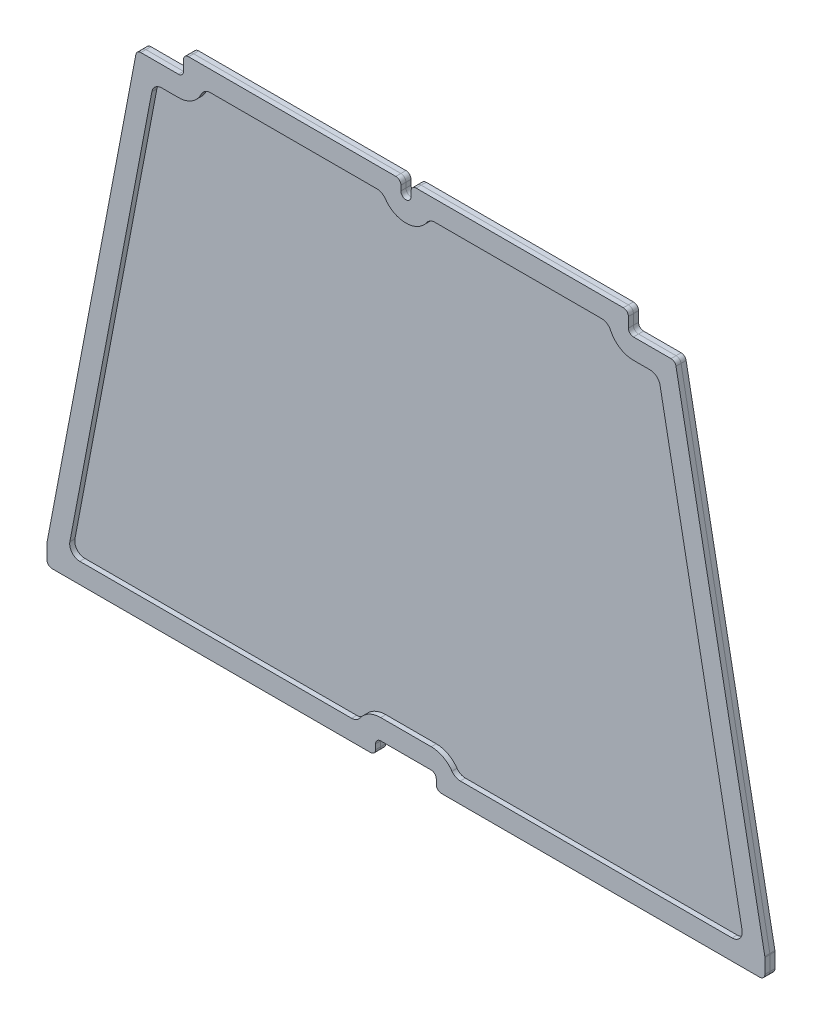
from build123d import *

# Parameters (mm, degrees)
EXTRUDE_1_DEPTH     = 5
CUT_EXTRUDE_1_DEPTH = 619.131054065
FILLET_1_R          = 5
EXTRUDE_2_DEPTH     = 5
FILLET_2_R          = 10


with BuildPart() as part:
    # ｽｹｯﾁ2 → ﾎﾞｽ - 押し出し1 (new body)
    with BuildSketch(Plane.XY):
        Polygon((355, 0), (-355, 0), (-355, 20), (-262.5, 506), (262.5, 506), (355, 20), align=None)
    extrude(amount=EXTRUDE_1_DEPTH)

    # ｽｹｯﾁ3 → ｶｯﾄ - 押し出し1 (cut, through all)
    with BuildSketch(Plane.XY.offset(5)):
        Polygon((-262.5, 506), (-266.306584362, 486), (-220, 486), (-220, 506), align=None)
        Polygon((262.5, 506), (220, 506), (220, 486), (266.306584362, 486), align=None)
        with BuildLine():
            Line((5, 506), (-5, 506))
            Line((-5, 506), (-5, 496))
            ThreePointArc((-5, 496), (0, 491), (5, 496))
            Line((5, 496), (5, 506))
        make_face()
        with BuildLine():
            Line((-30, 10), (-30, 0))
            Line((-30, 0), (30, 0))
            Line((30, 0), (30, 10))
            ThreePointArc((30, 10), (28.535533906, 13.535533906), (25, 15))
            Line((25, 15), (-25, 15))
            ThreePointArc((-25, 15), (-28.535533906, 13.535533906), (-30, 10))
        make_face()
    extrude(amount=-CUT_EXTRUDE_1_DEPTH, mode=Mode.SUBTRACT)

    # ﾌｨﾚｯﾄ1
    fillet_1_edges = [part.edges().sort_by_distance(p)[0] for p in [
        (-355, 20, 2.5),
        (355, 20, 2.5),
        (355, 0, 2.5),
        (-355, 0, 2.5),
        (-220, 486, 2.5),
        (-266.306584362, 486, 2.5),
        (-220, 506, 2.5),
        (266.306584362, 486, 2.5),
        (220, 486, 2.5),
        (220, 506, 2.5),
        (-5, 506, 2.5),
        (5, 506, 2.5),
        (30, 0, 2.5),
        (-30, 0, 2.5),
    ]]
    fillet(fillet_1_edges, radius=FILLET_1_R)


with BuildPart() as body_2:
    # ｽｹｯﾁ4 → ﾎﾞｽ - 押し出し2 (new body)
    with BuildSketch(Plane.XY.offset(5)):
        with BuildLine():
            Line((30, 10), (30, 5))
            ThreePointArc((30, 5), (31.464466094, 1.464466094), (35, 0))
            Line((35, 0), (350, 0))
            ThreePointArc((350, 0), (353.535533906, 1.464466094), (355, 5))
            Line((355, 5), (355, 19.528409825))
            ThreePointArc((355, 19.528409825), (354.977907561, 19.997916285), (354.911825474, 20.463273727))
            Line((354.911825474, 20.463273727), (267.080298537, 481.934863902))
            ThreePointArc((267.080298537, 481.934863902), (265.356394054, 484.851903394), (262.168473063, 486))
            Line((262.168473063, 486), (225, 486))
            ThreePointArc((225, 486), (221.464466094, 487.464466094), (220, 491))
            Line((220, 491), (220, 501))
            ThreePointArc((220, 501), (218.535533906, 504.535533906), (215, 506))
            Line((215, 506), (10, 506))
            ThreePointArc((10, 506), (6.464466094, 504.535533906), (5, 501))
            Line((5, 501), (5, 496))
            ThreePointArc((5, 496), (0, 491), (-5, 496))
            Line((-5, 496), (-5, 501))
            ThreePointArc((-5, 501), (-6.464466094, 504.535533906), (-10, 506))
            Line((-10, 506), (-215, 506))
            ThreePointArc((-215, 506), (-218.535533906, 504.535533906), (-220, 501))
            Line((-220, 501), (-220, 491))
            ThreePointArc((-220, 491), (-221.464466094, 487.464466094), (-225, 486))
            Line((-225, 486), (-262.168473063, 486))
            ThreePointArc((-262.168473063, 486), (-265.356394054, 484.851903394), (-267.080298537, 481.934863902))
            Line((-267.080298537, 481.934863902), (-354.911825474, 20.463273727))
            ThreePointArc((-354.911825474, 20.463273727), (-354.977907561, 19.997916285), (-355, 19.528409825))
            Line((-355, 19.528409825), (-355, 5))
            ThreePointArc((-355, 5), (-353.535533906, 1.464466094), (-350, 0))
            Line((-350, 0), (-35, 0))
            ThreePointArc((-35, 0), (-31.464466094, 1.464466094), (-30, 5))
            Line((-30, 5), (-30, 10))
            ThreePointArc((-30, 10), (-28.535533906, 13.535533906), (-25, 15))
            Line((-25, 15), (25, 15))
            ThreePointArc((25, 15), (28.535533906, 13.535533906), (30, 10))
        make_face()
        with BuildLine():
            Line((-225, 466), (-249.754139167, 466))
            Line((-249.754139167, 466), (-334.640970443, 20))
            Line((-334.640970443, 20), (-47.912878475, 20))
            ThreePointArc((-47.912878475, 20), (-38.693063938, 30.916500663), (-25, 35))
            Line((-25, 35), (25, 35))
            ThreePointArc((25, 35), (38.693063938, 30.916500663), (47.912878475, 20))
            Line((47.912878475, 20), (334.640970443, 20))
            Line((334.640970443, 20), (249.754139167, 466))
            Line((249.754139167, 466), (225, 466))
            ThreePointArc((225, 466), (209.188611699, 471.635083269), (200.505102572, 486))
            Line((200.505102572, 486), (22.912878475, 486))
            ThreePointArc((22.912878475, 486), (0, 471), (-22.912878475, 486))
            Line((-22.912878475, 486), (-200.505102572, 486))
            ThreePointArc((-200.505102572, 486), (-209.188611699, 471.635083269), (-225, 466))
        make_face(mode=Mode.SUBTRACT)
    extrude(amount=EXTRUDE_2_DEPTH)

    # ﾌｨﾚｯﾄ2
    fillet_2_edges = [body_2.edges().sort_by_distance(p)[0] for p in [
        (-200.505102572, 486, 7.5),
        (-249.754139167, 466, 7.5),
        (-334.640970443, 20, 7.5),
        (-47.912878475, 20, 7.5),
        (47.912878475, 20, 7.5),
        (334.640970443, 20, 7.5),
        (249.754139167, 466, 7.5),
        (200.505102572, 486, 7.5),
        (22.912878475, 486, 7.5),
        (-22.912878475, 486, 7.5),
    ]]
    fillet(fillet_2_edges, radius=FILLET_2_R)


solid = Compound([part.part, body_2.part])
